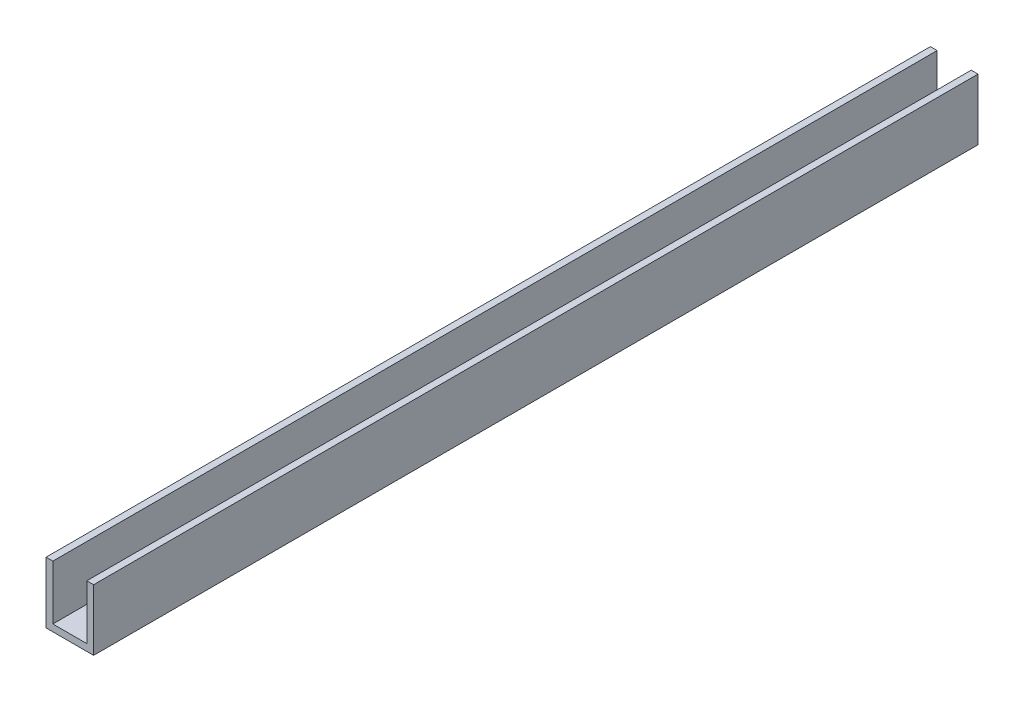
from build123d import *

# Parameters (mm, degrees)
BOSS_EXTRUDE2_DEPTH = 130


with BuildPart() as part:
    # Sketch2 → Boss-Extrude2 (new body)
    with BuildSketch(Plane.XY):
        Polygon((-3.5, 0), (3.5, 0), (3.5, 9), (2.5, 9), (2.5, 1), (-2.5, 1), (-2.5, 9), (-3.5, 9), align=None)
    extrude(amount=BOSS_EXTRUDE2_DEPTH)


solid = part.part
